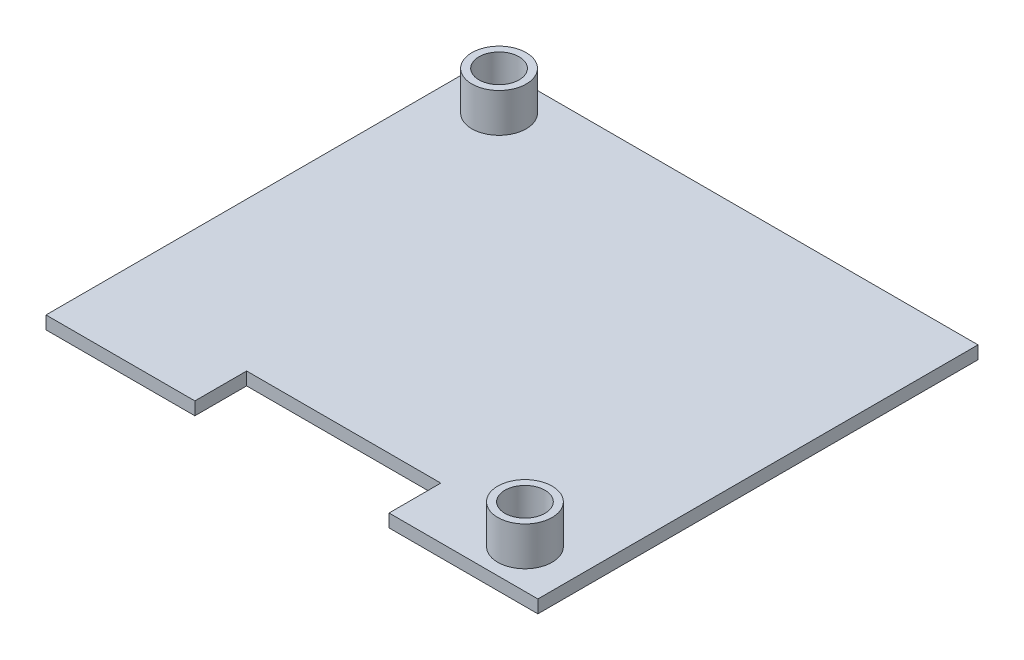
from build123d import *

# Parameters (mm, degrees)
SKETCH_1_W          = 38
SKETCH_1_H          = 34
MIDDLE_PLATE_DEPTH  = 1
MIDDLE_PILLAR_DEPTH = 3
C_CUT_REACH         = 27.807
SKETCH_3_W          = 15
SKETCH_3_H          = 4


with BuildPart() as part:
    # 스케치1 → Middle_plate (new body)
    with BuildSketch(Plane(origin=(0, 0, 0), x_dir=(1, 0, 0), z_dir=(0, 1, 0))):
        Rectangle(SKETCH_1_W, SKETCH_1_H)
    extrude(amount=MIDDLE_PLATE_DEPTH)

    # 스케치2 → Middle_pillar (add)
    with BuildSketch(Plane(origin=(0, 1, 0), x_dir=(1, 0, 0), z_dir=(0, 1, 0))):
        with BuildLine():
            ThreePointArc((17.1, -14), (16.48492424, -12.51507576), (15, -11.9))
            Line((15, -11.9), (15, -12.45))
            ThreePointArc((15, -12.45), (16.096015511, -12.903984489), (16.55, -14))
            ThreePointArc((16.55, -14), (15, -15.55), (13.45, -14))
            Line((13.45, -14), (12.9, -14))
            ThreePointArc((12.9, -14), (15, -16.1), (17.1, -14))
        make_face()
        with BuildLine():
            Line((15, -12.45), (15, -11.9))
            ThreePointArc((15, -11.9), (13.51507576, -12.51507576), (12.9, -14))
            Line((12.9, -14), (13.45, -14))
            ThreePointArc((13.45, -14), (13.903984489, -12.903984489), (15, -12.45))
        make_face()
        with BuildLine():
            ThreePointArc((-15, 12.45), (-16.096015511, 15.096015511), (-13.45, 14))
            Line((-13.45, 14), (-12.9, 14))
            ThreePointArc((-12.9, 14), (-16.48492424, 15.48492424), (-15, 11.9))
            Line((-15, 11.9), (-15, 12.45))
        make_face()
        with BuildLine():
            Line((-12.9, 14), (-13.45, 14))
            ThreePointArc((-13.45, 14), (-13.903984489, 12.903984489), (-15, 12.45))
            Line((-15, 12.45), (-15, 11.9))
            ThreePointArc((-15, 11.9), (-13.51507576, 12.51507576), (-12.9, 14))
        make_face()
    extrude(amount=MIDDLE_PILLAR_DEPTH)

    # 스케치3 → C_cut (cut, up to next)
    with BuildSketch(Plane.XZ, mode=Mode.PRIVATE) as c_cut_sk1:
        with Locations((0, 15)):
            Rectangle(SKETCH_3_W, SKETCH_3_H)
    c_cut_tool1 = extrude(c_cut_sk1.sketch, amount=-C_CUT_REACH, mode=Mode.PRIVATE) & part.part
    add(c_cut_tool1.solids().sort_by_distance((0, 0, 15))[0], mode=Mode.SUBTRACT)


solid = part.part
